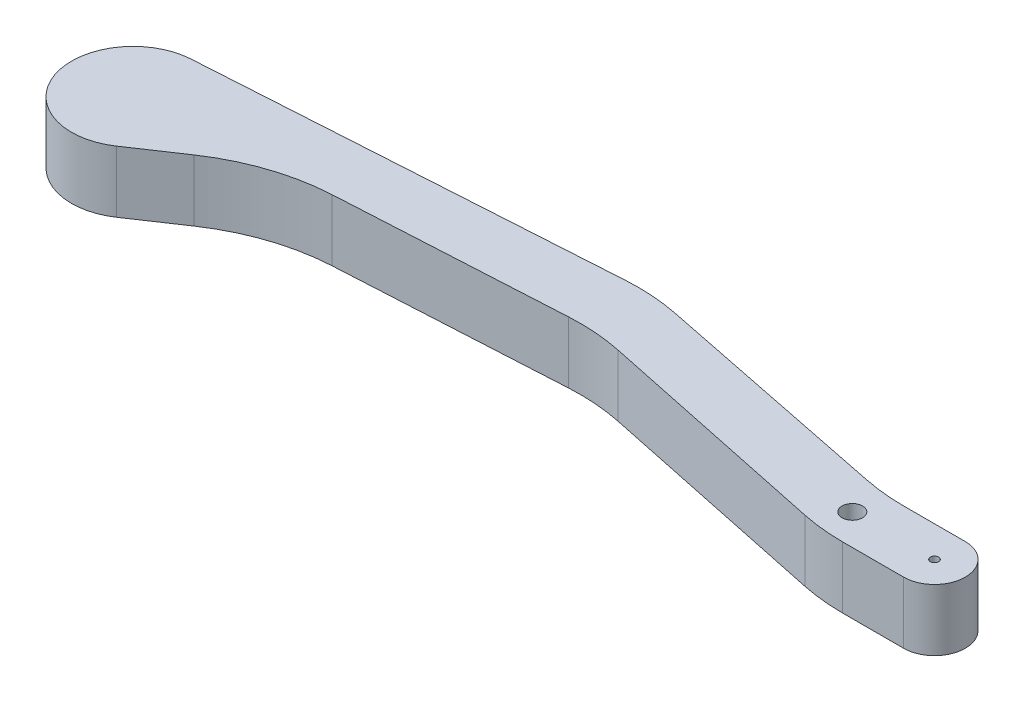
from build123d import *

# Parameters (mm, degrees)
SKETCH1_R           = 5
SKETCH1_R_2         = 2
BOSS_EXTRUDE1_DEPTH = 30
FILLET1_R           = 100


with BuildPart() as part:
    # Sketch1 → Boss-Extrude1 (new body)
    with BuildSketch(Plane(origin=(0, 0, 0), x_dir=(1, 0, 0), z_dir=(0, 1, 0))):
        with BuildLine():
            Line((0, 15), (-139.784941349, 43.225909045))
            Line((-139.784941349, 43.225909045), (-351.875415017, 29.941322925))
            ThreePointArc((-351.875415017, 29.941322925), (-378.412739548, -9.628926804), (-333.285739517, -24.912516864))
            Line((-333.285739517, -24.912516864), (-287.823465989, 5.588948968))
            Line((-287.823465989, 5.588948968), (-138.053278996, 13.889014505))
            Line((-138.053278996, 13.889014505), (-5.919683, -13.782501703))
            Line((-5.919683, -13.782501703), (0, -15))
            Line((0, -15), (40, -15))
            ThreePointArc((40, -15), (55, 0), (40, 15))
            Line((40, 15), (0, 15))
        make_face()
        with Locations(Location((0, 0, 0), (0, 0, 270))):
            Circle(SKETCH1_R, mode=Mode.SUBTRACT)
        with Locations(Location((40, 0, 0), (0, 0, 270))):
            Circle(SKETCH1_R_2, mode=Mode.SUBTRACT)
    extrude(amount=BOSS_EXTRUDE1_DEPTH)

    # Fillet1
    fillet1_edges = [part.edges().sort_by_distance(p)[0] for p in [
        (0, 15, -15),
        (-139.784941349, 15, -43.225909045),
        (-138.053278996, 15, -13.889014505),
        (-287.823465989, 15, -5.588948968),
        (0, 15, 15),
    ]]
    fillet(fillet1_edges, radius=FILLET1_R)


solid = part.part
